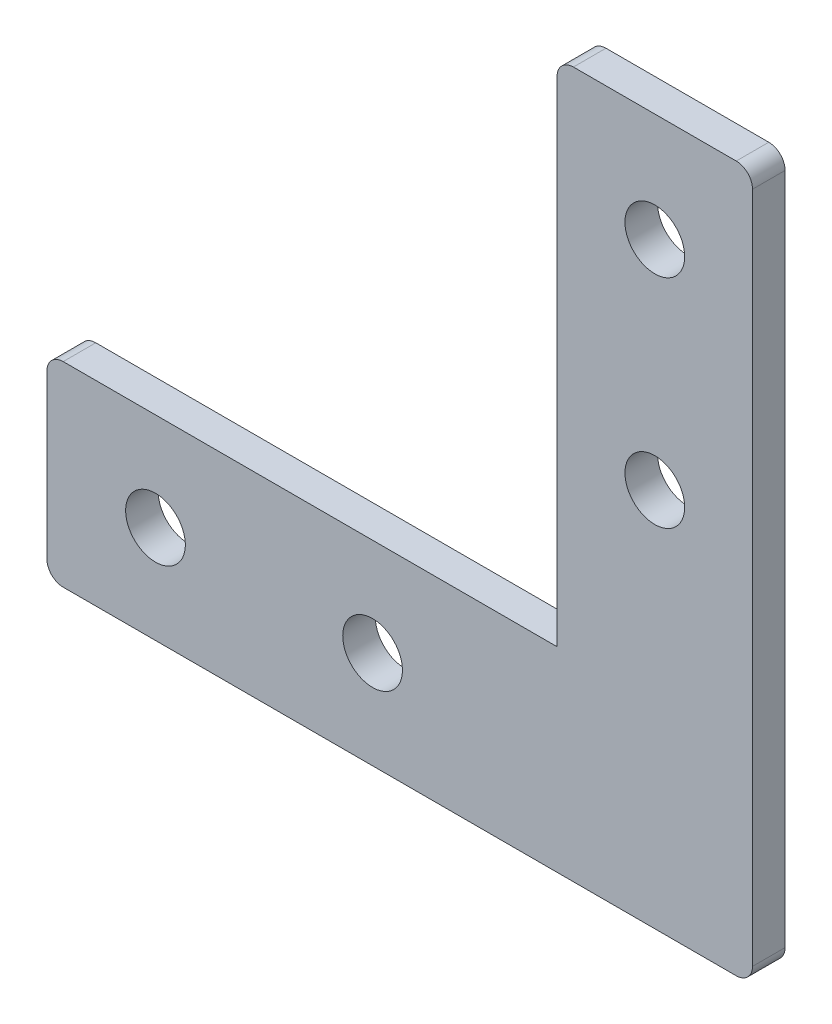
from build123d import *

# Parameters (mm, degrees)
SKETCH_1_R      = 2.75
EXTRUDE_1_DEPTH = 3


with BuildPart() as part:
    # 草图1 → 凸台-拉伸1 (new body)
    with BuildSketch(Plane.XY):
        with BuildLine():
            Line((0, 16.5), (0, 1.5))
            ThreePointArc((0, 1.5), (0.439339828, 0.439339828), (1.5, 0))
            Line((1.5, 0), (63.5, 0))
            ThreePointArc((63.5, 0), (64.560660172, 0.439339828), (65, 1.5))
            Line((65, 1.5), (65, 63.5))
            ThreePointArc((65, 63.5), (64.560660172, 64.560660172), (63.5, 65))
            Line((63.5, 65), (48.5, 65))
            ThreePointArc((48.5, 65), (47.439339828, 64.560660172), (47, 63.5))
            Line((47, 63.5), (47, 18))
            Line((47, 18), (1.5, 18))
            ThreePointArc((1.5, 18), (0.439339828, 17.560660172), (0, 16.5))
        make_face()
        with Locations(Location((10, 9, 0), (0, 0, 180))):
            Circle(SKETCH_1_R, mode=Mode.SUBTRACT)
        with Locations(Location((30, 9, 0), (0, 0, 180))):
            Circle(SKETCH_1_R, mode=Mode.SUBTRACT)
        with Locations(Location((56, 35, 0), (0, 0, 180))):
            Circle(SKETCH_1_R, mode=Mode.SUBTRACT)
        with Locations(Location((56, 55, 0), (0, 0, 180))):
            Circle(SKETCH_1_R, mode=Mode.SUBTRACT)
    extrude(amount=-EXTRUDE_1_DEPTH)


solid = part.part
